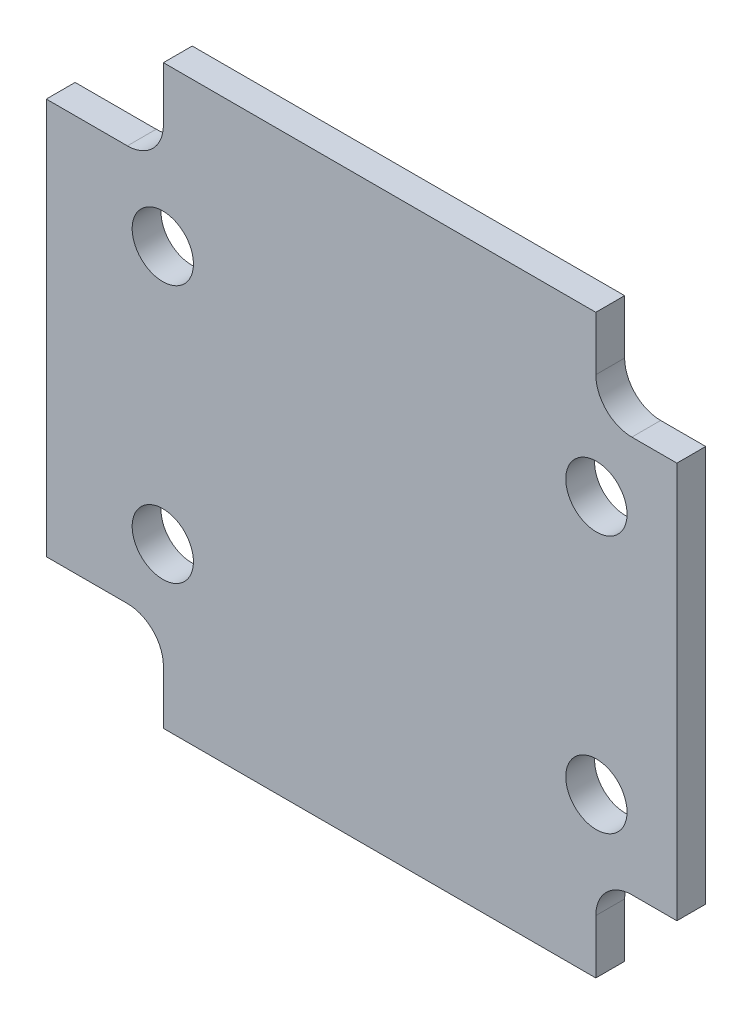
from build123d import *

# Parameters (mm, degrees)
SKETCH_1_W            = 37
SKETCH_1_H            = 32
EXTRUDE_1_DEPTH       = 1.6
SKETCH_2_W            = 6.5
SKETCH_2_H            = 5
CUT_EXTRUDE_1_DEPTH   = 25.511425907
FILLET_1_R            = 2
HOLE_WIZARD_M31_D     = 3.4
HOLE_WIZARD_M31_DEPTH = 18
HOLE_WIZARD_M31_TIP   = 1.021463052
SKETCH_7_W            = 1.6
SKETCH_7_H            = 24.851674328
CUT_EXTRUDE_2_DEPTH   = 2


with BuildPart() as part:
    # Эскиз1 → Бобышка-Вытянуть1 (new body)
    with BuildSketch(Plane.XY):
        Rectangle(SKETCH_1_W, SKETCH_1_H)
    extrude(amount=EXTRUDE_1_DEPTH)

    # Эскиз2 → Вырез-Вытянуть1 (cut, through all)
    with BuildSketch(Plane.XY.offset(1.6)):
        with Locations((-15.25, 13.5)):
            Rectangle(SKETCH_2_W, SKETCH_2_H)
        with Locations((15.25, 13.5)):
            Rectangle(SKETCH_2_W, SKETCH_2_H)
        with Locations((15.25, -13.5)):
            Rectangle(SKETCH_2_W, SKETCH_2_H)
        with Locations((-15.25, -13.5)):
            Rectangle(SKETCH_2_W, SKETCH_2_H)
    extrude(amount=-CUT_EXTRUDE_1_DEPTH, mode=Mode.SUBTRACT)

    # Скругление1
    fillet_1_edges = [part.edges().sort_by_distance(p)[0] for p in [
        (-12, 11, 0.8),
        (12, 11, 0.8),
        (12, -11, 0.8),
        (-12, -11, 0.8),
    ]]
    fillet(fillet_1_edges, radius=FILLET_1_R)

    # Отверстие с зазором M31
    with Locations(Plane.XY.offset(1.6)):
        with Locations((-12.033502432, 7.1550555), (12.033502432, 7.1550555), (12.033502432, -7.1550555), (-12.033502432, -7.1550555)):
            Hole(HOLE_WIZARD_M31_D / 2, depth=HOLE_WIZARD_M31_DEPTH)
            with Locations((0, 0, -(HOLE_WIZARD_M31_DEPTH + HOLE_WIZARD_M31_TIP / 2))):  # 118° drill point
                Cone(0, HOLE_WIZARD_M31_D / 2, HOLE_WIZARD_M31_TIP, mode=Mode.SUBTRACT)

    # Эскиз7 → Вырез-Вытянуть2 (cut)
    with BuildSketch(Plane(origin=(18.5, 0, 0), x_dir=(0, 0, -1), z_dir=(1, 0, 0))):
        with Locations((-0.8, 0)):
            Rectangle(SKETCH_7_W, SKETCH_7_H)
    extrude(amount=-CUT_EXTRUDE_2_DEPTH, mode=Mode.SUBTRACT)


solid = part.part
